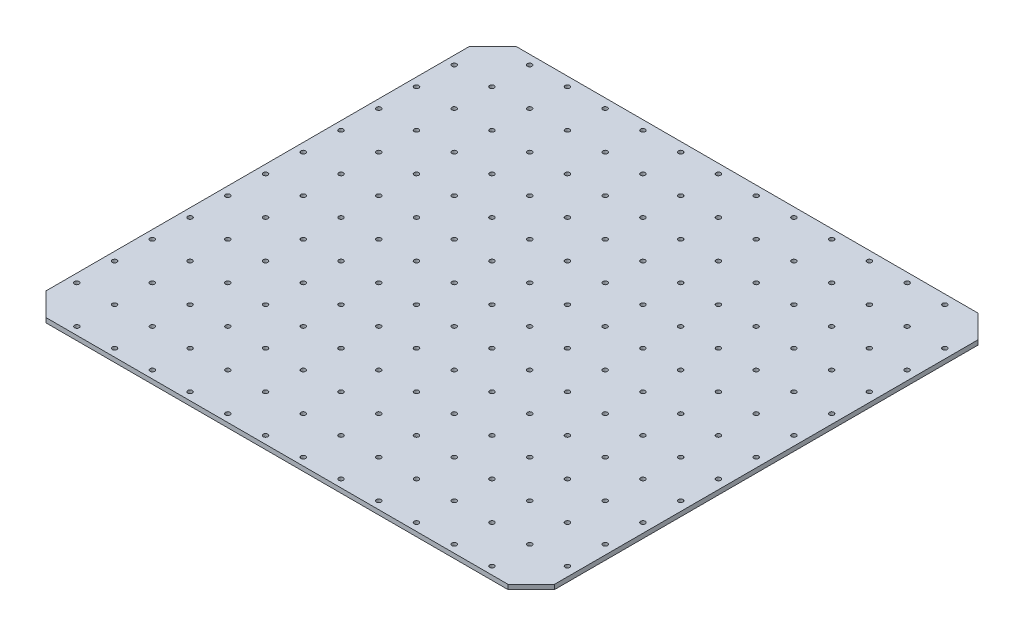
from build123d import *

# Parameters (mm, degrees)
BOSS_EXTRUDE1_DEPTH       = 3
F_3_0MM_DOWEL_SLOT3_D     = 3
F_3_0MM_DOWEL_SLOT3_DEPTH = 5.2
F_3_0MM_DOWEL_SLOT3_TIP   = 0.901290929


with BuildPart() as part:
    # Sketch3 → Boss-Extrude1 (new body)
    with BuildSketch(Plane(origin=(0, 0, 0), x_dir=(1, 0, 0), z_dir=(0, 1, 0))):
        Polygon((-289.107709539, -12.001540078), (-289.107709539, 262.998459922), (-274.107709539, 277.998459922), (25.892290461, 277.998459922), (40.892290461, 262.998459922), (40.892290461, -12.001540078), (25.892290461, -27.001540078), (-274.107709539, -27.001540078), align=None)
    extrude(amount=BOSS_EXTRUDE1_DEPTH)

    # Ø3.0mm Dowel Slot3
    with Locations(Plane(origin=(0, 3, 0), x_dir=(1, 0, 0), z_dir=(0, 1, 0))):
        with Locations((-259.107709539, -22.001540078), (-234.607709539, -22.001540078), (-210.107709539, -22.001540078), (-185.607709539, -22.001540078), (-161.107709539, -22.001540078), (-136.607709539, -22.001540078), (-112.107709539, -22.001540078), (-87.607709539, -22.001540078), (-63.107709539, -22.001540078), (-38.607709539, -22.001540078), (-14.107709539, -22.001540078), (10.392290461, -22.001540078), (-259.107709539, 2.498459922), (-259.107709539, 26.998459922), (-259.107709539, 51.498459922), (-259.107709539, 75.998459922), (-259.107709539, 100.498459922), (-259.107709539, 124.998459922), (-259.107709539, 149.498459922), (-259.107709539, 173.998459922), (-259.107709539, 198.498459922), (-259.107709539, 222.998459922), (-259.107709539, 247.498459922), (-259.107709539, 271.998459922), (-234.607709539, 2.498459922), (-210.107709539, 2.498459922), (-185.607709539, 2.498459922), (-161.107709539, 2.498459922), (-136.607709539, 2.498459922), (-112.107709539, 2.498459922), (-87.607709539, 2.498459922), (-63.107709539, 2.498459922), (-38.607709539, 2.498459922), (-14.107709539, 2.498459922), (10.392290461, 2.498459922), (-234.607709539, 26.998459922), (-210.107709539, 26.998459922), (-185.607709539, 26.998459922), (-161.107709539, 26.998459922), (-136.607709539, 26.998459922), (-112.107709539, 26.998459922), (-87.607709539, 26.998459922), (-63.107709539, 26.998459922), (-38.607709539, 26.998459922), (-14.107709539, 26.998459922), (10.392290461, 26.998459922), (-234.607709539, 51.498459922), (-210.107709539, 51.498459922), (-185.607709539, 51.498459922), (-161.107709539, 51.498459922), (-136.607709539, 51.498459922), (-112.107709539, 51.498459922), (-87.607709539, 51.498459922), (-63.107709539, 51.498459922), (-38.607709539, 51.498459922), (-14.107709539, 51.498459922), (10.392290461, 51.498459922), (-234.607709539, 75.998459922), (-210.107709539, 75.998459922), (-185.607709539, 75.998459922), (-161.107709539, 75.998459922), (-136.607709539, 75.998459922), (-112.107709539, 75.998459922), (-87.607709539, 75.998459922), (-63.107709539, 75.998459922), (-38.607709539, 75.998459922), (-14.107709539, 75.998459922), (10.392290461, 75.998459922), (-234.607709539, 100.498459922), (-210.107709539, 100.498459922), (-185.607709539, 100.498459922), (-161.107709539, 100.498459922), (-136.607709539, 100.498459922), (-112.107709539, 100.498459922), (-87.607709539, 100.498459922), (-63.107709539, 100.498459922), (-38.607709539, 100.498459922), (-14.107709539, 100.498459922), (10.392290461, 100.498459922), (-234.607709539, 124.998459922), (-210.107709539, 124.998459922), (-185.607709539, 124.998459922), (-161.107709539, 124.998459922), (-136.607709539, 124.998459922), (-112.107709539, 124.998459922), (-87.607709539, 124.998459922), (-63.107709539, 124.998459922), (-38.607709539, 124.998459922), (-14.107709539, 124.998459922), (10.392290461, 124.998459922), (-234.607709539, 149.498459922), (-210.107709539, 149.498459922), (-185.607709539, 149.498459922), (-161.107709539, 149.498459922), (-136.607709539, 149.498459922), (-112.107709539, 149.498459922), (-87.607709539, 149.498459922), (-63.107709539, 149.498459922), (-38.607709539, 149.498459922), (-14.107709539, 149.498459922), (10.392290461, 149.498459922), (-234.607709539, 173.998459922), (-210.107709539, 173.998459922), (-185.607709539, 173.998459922), (-161.107709539, 173.998459922), (-136.607709539, 173.998459922), (-112.107709539, 173.998459922), (-87.607709539, 173.998459922), (-63.107709539, 173.998459922), (-38.607709539, 173.998459922), (-14.107709539, 173.998459922), (10.392290461, 173.998459922), (-234.607709539, 198.498459922), (-210.107709539, 198.498459922), (-185.607709539, 198.498459922), (-161.107709539, 198.498459922), (-136.607709539, 198.498459922), (-112.107709539, 198.498459922), (-87.607709539, 198.498459922), (-63.107709539, 198.498459922), (-38.607709539, 198.498459922), (-14.107709539, 198.498459922), (10.392290461, 198.498459922), (-234.607709539, 222.998459922), (-210.107709539, 222.998459922), (-185.607709539, 222.998459922), (-161.107709539, 222.998459922), (-136.607709539, 222.998459922), (-112.107709539, 222.998459922), (-87.607709539, 222.998459922), (-63.107709539, 222.998459922), (-38.607709539, 222.998459922), (-14.107709539, 222.998459922), (10.392290461, 222.998459922), (-234.607709539, 247.498459922), (-210.107709539, 247.498459922), (-185.607709539, 247.498459922), (-161.107709539, 247.498459922), (-136.607709539, 247.498459922), (-112.107709539, 247.498459922), (-87.607709539, 247.498459922), (-63.107709539, 247.498459922), (-38.607709539, 247.498459922), (-14.107709539, 247.498459922), (10.392290461, 247.498459922), (-234.607709539, 271.998459922), (-210.107709539, 271.998459922), (-185.607709539, 271.998459922), (-161.107709539, 271.998459922), (-136.607709539, 271.998459922), (-112.107709539, 271.998459922), (-87.607709539, 271.998459922), (-63.107709539, 271.998459922), (-38.607709539, 271.998459922), (-14.107709539, 271.998459922), (10.392290461, 271.998459922), (34.892290461, 2.498459922), (34.892290461, 26.998459922), (34.892290461, 51.498459922), (34.892290461, 75.998459922), (34.892290461, 100.498459922), (34.892290461, 124.998459922), (34.892290461, 149.498459922), (34.892290461, 173.998459922), (34.892290461, 198.498459922), (34.892290461, 222.998459922), (34.892290461, 247.498459922), (-283.607709539, 2.498459922), (-283.607709539, 26.998459922), (-283.607709539, 51.498459922), (-283.607709539, 75.998459922), (-283.607709539, 100.498459922), (-283.607709539, 124.998459922), (-283.607709539, 149.498459922), (-283.607709539, 173.998459922), (-283.607709539, 198.498459922), (-283.607709539, 222.998459922), (-283.607709539, 247.498459922)):
            Hole(F_3_0MM_DOWEL_SLOT3_D / 2, depth=F_3_0MM_DOWEL_SLOT3_DEPTH)
            with Locations((0, 0, -(F_3_0MM_DOWEL_SLOT3_DEPTH + F_3_0MM_DOWEL_SLOT3_TIP / 2))):  # 118° drill point
                Cone(0, F_3_0MM_DOWEL_SLOT3_D / 2, F_3_0MM_DOWEL_SLOT3_TIP, mode=Mode.SUBTRACT)


solid = part.part
